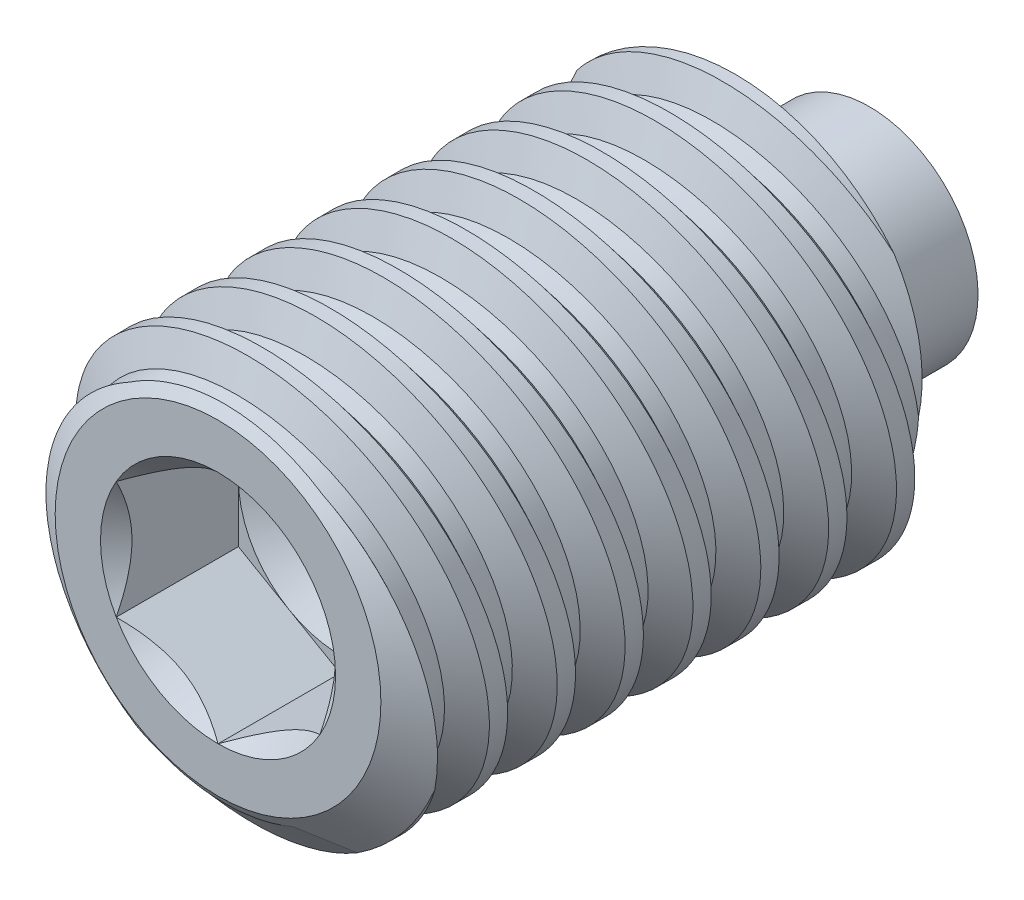
from build123d import *

# Parameters (mm, degrees)
LPATTERN1_COUNT      = 9
LPATTERN1_PITCH      = 0.5
LPATTERN1_COUNT_DIR2 = 2
LPATTERN1_PITCH_DIR2 = 0.5
CUT_EXTRUDE10_DEPTH  = 0.9


with BuildPart() as part:
    # Sketch22 → Revolve1 (revolve)
    with BuildSketch(Plane(origin=(0, 0, 0), x_dir=(0, 0, -1), z_dir=(1, 0, 0)), mode=Mode.PRIVATE) as revolve1_sk:
        Polygon((-2.4, 0), (-2.4, 1.2), (-2.189937739, 1.5), (1.412435565, 1.5), (1.6, 0.8), (2.4, 0.8), (2.4, 0), align=None)
    revolve(revolve1_sk.sketch.rotate(Axis((0, 0, -2.4), (0, 0, -1)), 180), axis=Axis((0, 0, -2.4), (0, 0, -1)))

    # Sketch6 → Cut-Revolve8 (revolve, cut)
    with BuildSketch(Plane(origin=(0, 0, 0), x_dir=(0, 0, -1), z_dir=(1, 0, 0))):
        Polygon((1.241153676, 1.289561466), (1.117854435, 1.269011592), (0.919238603, 1.510274937), (1.350785945, 1.582199494), align=None)
    cut_revolve8 = revolve(axis=Axis((0, 0.089188249, -1.92784797), (0, -0.16439898730536232, 0.986393923832143)), mode=Mode.SUBTRACT)

    # LPattern1: Cut-Revolve8 9 × 2
    with Locations(*[Vector(0, 0, 1) * (i * LPATTERN1_PITCH) + Vector(0, 0, 1) * (j * LPATTERN1_PITCH_DIR2) for i in range(LPATTERN1_COUNT) for j in range(LPATTERN1_COUNT_DIR2) if (i, j) != (0, 0)]):
        add(cut_revolve8, mode=Mode.SUBTRACT)

    # Sketch23 → Cut-Extrude10 (cut)
    with BuildSketch(Plane.XY.offset(2.4)):
        Polygon((0, 0.866025404), (-0.75, 0.433012702), (-0.75, -0.433012702), (0, -0.866025404), (0.75, -0.433012702), (0.75, 0.433012702), align=None)
    extrude(amount=-CUT_EXTRUDE10_DEPTH, mode=Mode.SUBTRACT)

    # Cut-Extrude11 cone 1 section (through the dimple's axis) → Cut-Extrude11 (revolve, cut)
    with BuildSketch(Plane(origin=(0, 0, 2.4), x_dir=(0, -1, 0), z_dir=(1, 0, 0))):
        Polygon((0, 0), (0.866025404, 0), (0, 0.866025404), align=None)
    revolve(axis=Axis((0, 0, 2.4), (0, 0, -1)), mode=Mode.SUBTRACT)

    # Cut-Extrude12 cone 1 section (through the dimple's axis) → Cut-Extrude12 (revolve, cut)
    with BuildSketch(Plane(origin=(0, 0, 1.5), x_dir=(0, -1, 0), z_dir=(1, 0, 0))):
        Polygon((0, 0), (0.75, 0), (0, 0.450645464), align=None)
    revolve(axis=Axis((0, 0, 1.5), (0, 0, -1)), mode=Mode.SUBTRACT)


solid = part.part
